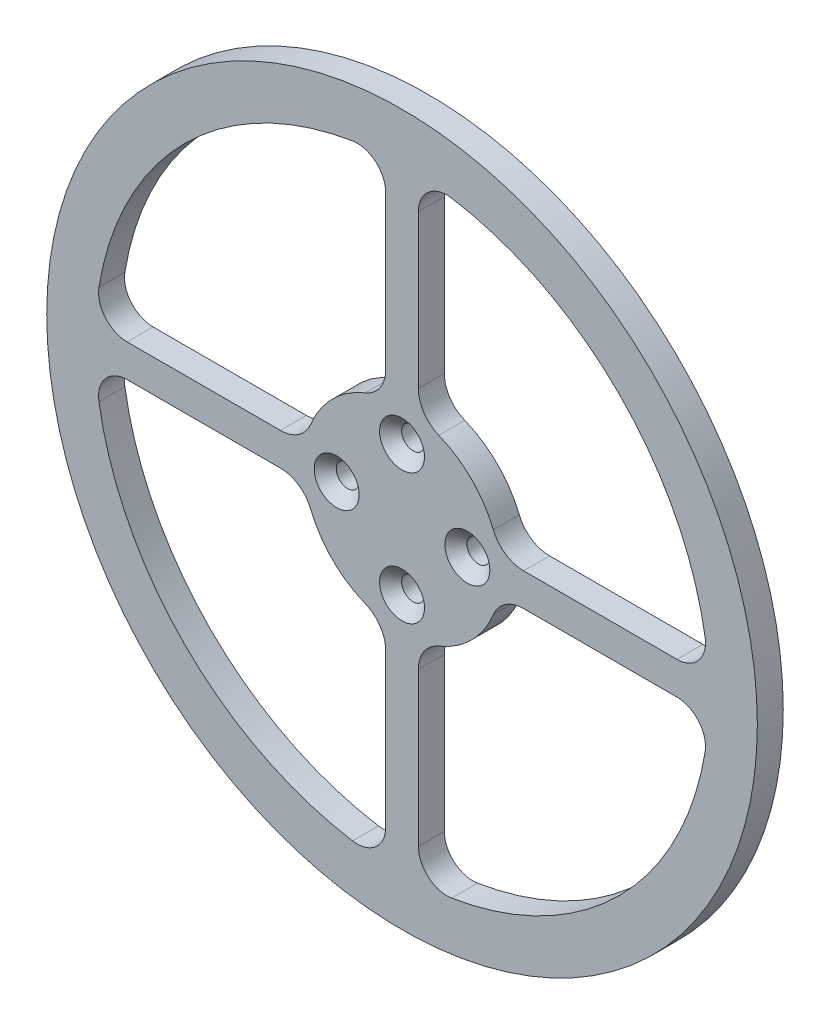
from build123d import *

# Parameters (mm, degrees)
SKETCH1_R           = 43.5
SKETCH1_R_2         = 1.4
BOSS_EXTRUDE1_DEPTH = 3.175
FILLET1_R           = 4
FILLET2_R           = 3.5
SKETCH3_R           = 3.15
BOSS_EXTRUDE2_DEPTH = 3.175
CHAMFER1_SIZE       = 1.35


with BuildPart() as part:
    # Sketch1 → Boss-Extrude1 (new body)
    with BuildSketch(Plane.XY):
        Circle(SKETCH1_R)
        with Locations((0, 8)):
            Circle(SKETCH1_R_2, mode=Mode.SUBTRACT)
        with Locations((0, -8)):
            Circle(SKETCH1_R_2, mode=Mode.SUBTRACT)
        with Locations((8, 0)):
            Circle(SKETCH1_R_2, mode=Mode.SUBTRACT)
        with Locations((-8, 0)):
            Circle(SKETCH1_R_2, mode=Mode.SUBTRACT)
        with BuildLine():
            Line((-37.546770833, -2), (-11.882865816, -2))
            ThreePointArc((-11.882865816, -2), (-8.520636713, -8.520636713), (-2, -11.882865816))
            Line((-2, -11.882865816), (-2, -37.546770833))
            ThreePointArc((-2, -37.546770833), (-26.587214973, -26.587214973), (-37.546770833, -2))
        make_face(mode=Mode.SUBTRACT)
        with BuildLine():
            Line((-2, 37.546770833), (-2, 11.882865816))
            ThreePointArc((-2, 11.882865816), (-8.520636713, 8.520636713), (-11.882865816, 2))
            Line((-11.882865816, 2), (-37.546770833, 2))
            ThreePointArc((-37.546770833, 2), (-26.587214973, 26.587214973), (-2, 37.546770833))
        make_face(mode=Mode.SUBTRACT)
        with BuildLine():
            Line((2, 37.546770833), (2, 11.882865816))
            ThreePointArc((2, 11.882865816), (8.520636713, 8.520636713), (11.882865816, 2))
            Line((11.882865816, 2), (37.546770833, 2))
            ThreePointArc((37.546770833, 2), (26.587214973, 26.587214973), (2, 37.546770833))
        make_face(mode=Mode.SUBTRACT)
        with BuildLine():
            Line((11.882865816, -2), (37.546770833, -2))
            ThreePointArc((37.546770833, -2), (26.587214973, -26.587214973), (2, -37.546770833))
            Line((2, -37.546770833), (2, -11.882865816))
            ThreePointArc((2, -11.882865816), (8.520636713, -8.520636713), (11.882865816, -2))
        make_face(mode=Mode.SUBTRACT)
    extrude(amount=BOSS_EXTRUDE1_DEPTH)

    # Fillet1
    fillet1_edges = [part.edges().sort_by_distance(p)[0] for p in [
        (-11.882865816, 2, 1.5875),
        (-2, 11.882865816, 1.5875),
        (-2, -11.882865816, 1.5875),
        (-11.882865816, -2, 1.5875),
        (11.882865816, -2, 1.5875),
        (2, -11.882865816, 1.5875),
        (2, 11.882865816, 1.5875),
        (11.882865816, 2, 1.5875),
    ]]
    fillet(fillet1_edges, radius=FILLET1_R)

    # Fillet2
    fillet2_edges = [part.edges().sort_by_distance(p)[0] for p in [
        (-2, 37.546770833, 1.5875),
        (-37.546770833, 2, 1.5875),
        (-37.546770833, -2, 1.5875),
        (-2, -37.546770833, 1.5875),
        (2, -37.546770833, 1.5875),
        (37.546770833, -2, 1.5875),
        (37.546770833, 2, 1.5875),
        (2, 37.546770833, 1.5875),
    ]]
    fillet(fillet2_edges, radius=FILLET2_R)

    # Sketch3 → Boss-Extrude2 (add)
    with BuildSketch(Plane(origin=(0, 0, 0), x_dir=(-1, 0, 0), z_dir=(0, 0, -1))):
        with Locations(Location((0, 0, 0), (0, 0, 180))):
            Circle(SKETCH3_R)
    extrude(amount=BOSS_EXTRUDE2_DEPTH)

    # Chamfer1
    chamfer1_edges = [part.edges().sort_by_distance(p)[0] for p in [
        (6.6, 0, 3.175),
        (-9.4, 0, 3.175),
        (-1.4, 8, 3.175),
        (-1.4, -8, 3.175),
    ]]
    chamfer(chamfer1_edges, length=CHAMFER1_SIZE)


solid = part.part
